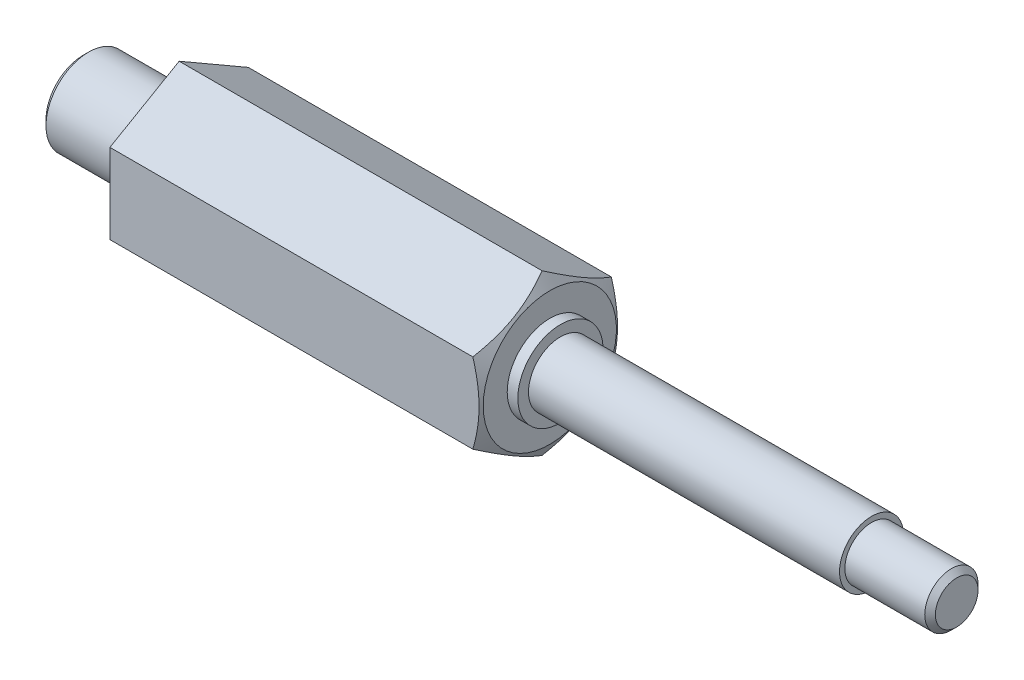
from build123d import *

# Parameters (mm, degrees)
BOSS_EXTRUDE1_START = -9
BOSS_EXTRUDE1_DEPTH = 82
CHAMFER1_SIZE       = 0.5


with BuildPart() as part:
    # Sketch1 → Boss-Extrude1 (new body)
    with BuildSketch(Plane(origin=(0, 0, 0), x_dir=(0, 0, -1), z_dir=(1, 0, 0)).offset(BOSS_EXTRUDE1_START)):
        Polygon((0, 7.505553499), (-6.5, 3.75277675), (-6.5, -3.75277675), (0, -7.505553499), (6.5, -3.75277675), (6.5, 3.75277675), align=None)
    extrude(amount=BOSS_EXTRUDE1_DEPTH)

    # Sketch2 → Cut-Revolve1 (revolve, cut)
    with BuildSketch(Plane.XY, mode=Mode.PRIVATE) as cut_revolve1_sk:
        Polygon((0, 7.505553499), (-9, 7.505553499), (-9, 4), (-1, 4), (-1, 3.45), (0, 3.45), align=None)
    revolve(cut_revolve1_sk.sketch.rotate(Axis((-20.13204944, 0, 0), (1, 0, 0)), 90), axis=Axis((-20.13204944, 0, 0), (1, 0, 0)), mode=Mode.SUBTRACT)

    # Sketch3 → Cut-Revolve2 (revolve, cut)
    with BuildSketch(Plane.XY, mode=Mode.PRIVATE) as cut_revolve2_sk:
        Polygon((34.8, 7.505553499), (34.8, 4), (35.8, 4), (35.8, 3), (65, 3), (65, 2.5), (73, 2.5), (73, 7.505553499), align=None)
    revolve(cut_revolve2_sk.sketch.rotate(Axis((-14.24617289, 0, 0), (1, 0, 0)), 90), axis=Axis((-14.24617289, 0, 0), (1, 0, 0)), mode=Mode.SUBTRACT)

    # Sketch4 → Cut-Revolve3 (revolve, cut)
    with BuildSketch(Plane.XY, mode=Mode.PRIVATE) as cut_revolve3_sk:
        Polygon((34.8, 7.505553499), (34.075105849, 7.505553499), (34.8, 6.25), align=None)
    revolve(cut_revolve3_sk.sketch.rotate(Axis((-12.936203068, 0, 0), (1, 0, 0)), 90), axis=Axis((-12.936203068, 0, 0), (1, 0, 0)), mode=Mode.SUBTRACT)

    # Chamfer1
    chamfer1_edges = [part.edges().sort_by_distance(p)[0] for p in [
        (-9, 0, -4),
        (73, 0, -2.5),
    ]]
    chamfer(chamfer1_edges, length=CHAMFER1_SIZE)


solid = part.part
